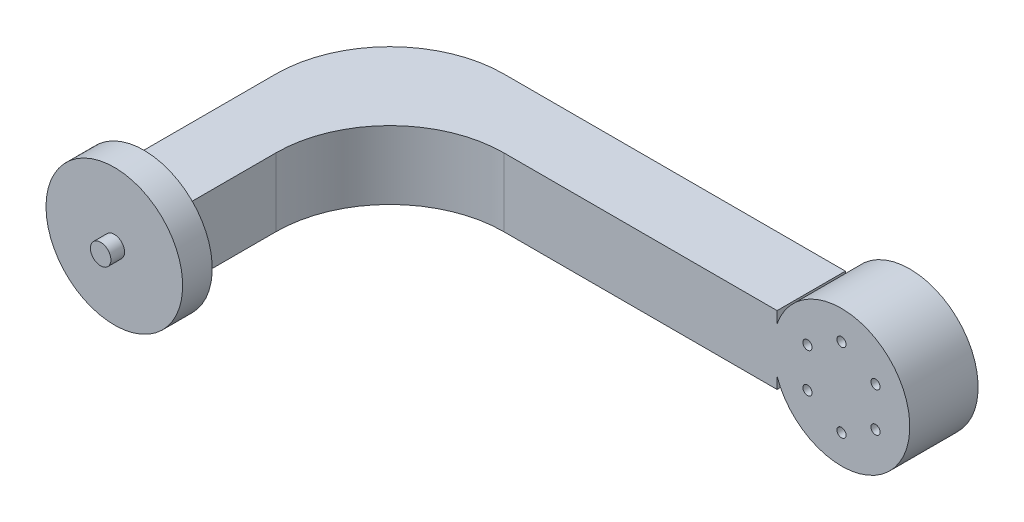
from build123d import *

# Parameters (mm, degrees)
EXTRUDE_1_DEPTH          = 30
SKETCH_12_W              = 30
SKETCH_12_H              = 93
EXTRUDE_6_DEPTH          = 30
SKETCH_16_R              = 30
EXTRUDE_9_DEPTH          = 13
FILLET_1_R               = 50
FILLET_2_R               = 50
SKETCH_17_R              = 2
CUT_EXTRUDE_1_DEPTH      = 193.846857699
PATTERN_CIRCULAR_1_COUNT = 6
SKETCH_18_R              = 4.5
EXTRUDE_10_DEPTH         = 6


with BuildPart() as part:
    # 草图1 → 凸台-拉伸1 (new body)
    with BuildSketch(Plane.XY):
        Polygon((100, -10), (100, 0), (100, 10), (100, 15), (-100, 15), (-100, -15), (100, -15), align=None)
        with BuildLine():
            Line((100, 10), (100, 0))
            Line((100, 0), (100, -10))
            ThreePointArc((100, -10), (158.284271247, 0), (100, 10))
        make_face()
    extrude(amount=EXTRUDE_1_DEPTH)

    # 草图12 → 凸台-拉伸6 (add)
    with BuildSketch(Plane(origin=(0, 15, 0), x_dir=(1, 0, 0), z_dir=(0, 1, 0))):
        with Locations((-85, -76.5)):
            Rectangle(SKETCH_12_W, SKETCH_12_H)
    extrude(amount=-EXTRUDE_6_DEPTH)

    # 草图16 → 凸台-拉伸9 (add)
    with BuildSketch(Plane.XY.offset(123)):
        with Locations(Location((-85, 0, 0), (0, 0, 180))):
            Circle(SKETCH_16_R)
    extrude(amount=EXTRUDE_9_DEPTH)

    # 圆角1
    fillet_1_edges = [part.edges().sort_by_distance(p)[0] for p in [
        (-70, 0, 30),
    ]]
    fillet(fillet_1_edges, radius=FILLET_1_R)

    # 圆角2
    fillet_2_edges = [part.edges().sort_by_distance(p)[0] for p in [
        (-100, 0, 0),
    ]]
    fillet(fillet_2_edges, radius=FILLET_2_R)

    # 草图17 → 切除-拉伸1 (cut, through all)
    with BuildSketch(Plane.XY.offset(30)):
        with Locations((128.284271247, 17.25)):
            Circle(SKETCH_17_R)
    cut_extrude_1 = extrude(amount=-CUT_EXTRUDE_1_DEPTH, mode=Mode.SUBTRACT)

    # 阵列(圆周)1: 切除-拉伸1 ×6 about axis
    pattern_circular_1_axis = Axis((128.284271247, 0, 0), (0, 0, 1))
    for i in range(1, PATTERN_CIRCULAR_1_COUNT):
        add(cut_extrude_1.rotate(pattern_circular_1_axis, i * 360 / PATTERN_CIRCULAR_1_COUNT), mode=Mode.SUBTRACT)

    # 草图18 → 凸台-拉伸10 (add)
    with BuildSketch(Plane.XY.offset(136)):
        with Locations((-85, 0)):
            Circle(SKETCH_18_R)
    extrude(amount=EXTRUDE_10_DEPTH)


solid = part.part
